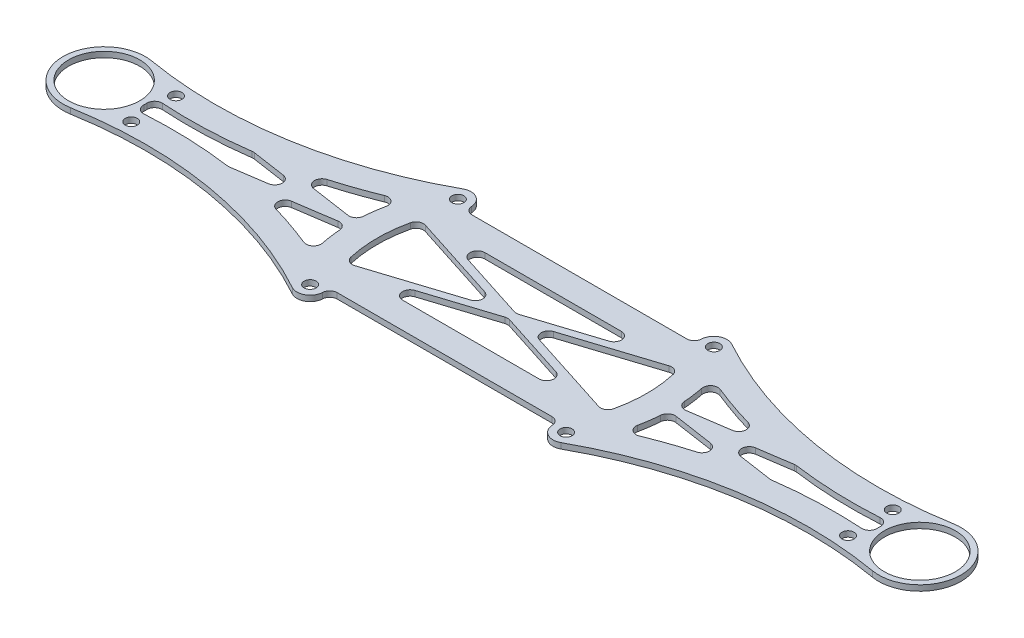
from build123d import *

# Parameters (mm, degrees)
BOSS_EXTRUDE1_DEPTH        = 0.75
F_3_2_3_2_DIAMETER_HOLE1_D = 3.2
SKETCH4_R                  = 9.5
CUT_EXTRUDE1_DEPTH         = 123.2407972
CUT_EXTRUDE4_DEPTH         = 123.2407972
FILLET1_R                  = 2


with BuildPart() as part:
    # Sketch1 → Boss-Extrude1 (new, symmetric)
    with BuildSketch(Plane(origin=(0, 0, 0), x_dir=(1, 0, 0), z_dir=(0, 1, 0))):
        with BuildLine():
            Line((31.176914536, 18), (-31.176914536, 18))
            ThreePointArc((-31.176914536, 18), (-31.70932212, 22.200834881), (-35.899079455, 22.81435343))
            ThreePointArc((-35.899079455, 22.81435343), (-70.492179883, 10.7556392), (-107.126701642, 10.839315166))
            ThreePointArc((-107.126701642, 10.839315166), (-120, 0), (-107.126701642, -10.839315166))
            ThreePointArc((-107.126701642, -10.839315166), (-70.492179883, -10.7556392), (-35.899079455, -22.81435343))
            ThreePointArc((-35.899079455, -22.81435343), (-31.70932212, -22.200834881), (-31.176914536, -18))
            Line((-31.176914536, -18), (31.176914536, -18))
            ThreePointArc((31.176914536, -18), (31.70932212, -22.200834881), (35.899079455, -22.81435343))
            ThreePointArc((35.899079455, -22.81435343), (70.492179883, -10.7556392), (107.126701642, -10.839315166))
            ThreePointArc((107.126701642, -10.839315166), (120, 0), (107.126701642, 10.839315166))
            ThreePointArc((107.126701642, 10.839315166), (70.492179883, 10.7556392), (35.899079455, 22.81435343))
            ThreePointArc((35.899079455, 22.81435343), (31.70932212, 22.200834881), (31.176914536, 18))
        make_face()
    extrude(amount=BOSS_EXTRUDE1_DEPTH, both=True)

    # Ø3.2 (3.2) Diameter Hole1 (through all)
    with Locations(Plane(origin=(0, 0.75, 0), x_dir=(1, 0, 0), z_dir=(0, 1, 0))):
        with Locations((-34.208003449, 19.75), (-34.208003449, -19.75), (34.208003449, -19.75), (34.208003449, 19.75), (-95.790276336, 5.979398024), (-95.790276336, -5.979398024), (95.790276336, 5.979398024), (95.790276336, -5.979398024)):
            Hole(F_3_2_3_2_DIAMETER_HOLE1_D / 2)

    # Sketch4 → Cut-Extrude1 (cut, through all)
    with BuildSketch(Plane(origin=(0, 0.75, 0), x_dir=(1, 0, 0), z_dir=(0, 1, 0))):
        with BuildLine():
            Line((-66.096117167, 4.443764231), (-42.988154947, 1.009224591))
            ThreePointArc((-42.988154947, 1.009224591), (-42.467311238, 6.747405149), (-41.183985346, 12.36443897))
            ThreePointArc((-41.183985346, 12.36443897), (-53.416219701, 7.70010587), (-66.096117167, 4.443764231))
        make_face()
        with BuildLine():
            ThreePointArc((-41.183985346, -12.36443897), (-42.467311238, -6.747405149), (-42.988154947, -1.009224591))
            Line((-42.988154947, -1.009224591), (-66.096117167, -4.443764231))
            ThreePointArc((-66.096117167, -4.443764231), (-53.416219701, -7.70010587), (-41.183985346, -12.36443897))
        make_face()
        with BuildLine():
            Line((-72.469338063, -3.369046694), (-49.802019621, 0))
            Line((-49.802019621, 0), (-72.469338063, 3.369046694))
            ThreePointArc((-72.469338063, 3.369046694), (-85.377857375, 2.290839769), (-98.326107181, 2.65857332))
            ThreePointArc((-98.326107181, 2.65857332), (-98, 0), (-98.326107181, -2.65857332))
            ThreePointArc((-98.326107181, -2.65857332), (-85.377857375, -2.290839769), (-72.469338063, -3.369046694))
        make_face()
        with BuildLine():
            ThreePointArc((-99.923426167, 2.804604689), (-118.5, 0), (-99.923426167, -2.804604689))
            ThreePointArc((-99.923426167, -2.804604689), (-99.5, 0), (-99.923426167, 2.804604689))
        make_face()
        with BuildLine():
            Line((72.469338063, 3.369046694), (49.802019621, 0))
            Line((49.802019621, 0), (72.469338063, -3.369046694))
            ThreePointArc((72.469338063, -3.369046694), (85.377857375, -2.290839769), (98.326107181, -2.65857332))
            ThreePointArc((98.326107181, -2.65857332), (98, 0), (98.326107181, 2.65857332))
            ThreePointArc((98.326107181, 2.65857332), (85.377857375, 2.290839769), (72.469338063, 3.369046694))
        make_face()
        with BuildLine():
            ThreePointArc((41.183985346, 12.36443897), (42.467311238, 6.747405149), (42.988154947, 1.009224591))
            Line((42.988154947, 1.009224591), (66.096117167, 4.443764231))
            ThreePointArc((66.096117167, 4.443764231), (53.416219701, 7.70010587), (41.183985346, 12.36443897))
        make_face()
        with BuildLine():
            Line((66.096117167, -4.443764231), (42.988154947, -1.009224591))
            ThreePointArc((42.988154947, -1.009224591), (42.467311238, -6.747405149), (41.183985346, -12.36443897))
            ThreePointArc((41.183985346, -12.36443897), (53.416219701, -7.70010587), (66.096117167, -4.443764231))
        make_face()
        with Locations((109, 0)):
            Circle(SKETCH4_R)
    extrude(amount=-CUT_EXTRUDE1_DEPTH, mode=Mode.SUBTRACT)

    # Sketch5 → Cut-Extrude4 (cut, through all)
    with BuildSketch(Plane(origin=(0, 0.75, 0), x_dir=(1, 0, 0), z_dir=(0, 1, 0))):
        Polygon((31.005545729, 11), (-31.005545729, 11), (0, 1.050227939), align=None)
        with BuildLine():
            Line((-3.272727273, 0), (-34.570601363, 10.043581104))
            ThreePointArc((-34.570601363, 10.043581104), (-36, 0), (-34.570601363, -10.043581104))
            Line((-34.570601363, -10.043581104), (-3.272727273, 0))
        make_face()
        with BuildLine():
            Line((34.570601363, 10.043581104), (3.272727273, 0))
            Line((3.272727273, 0), (34.570601363, -10.043581104))
            ThreePointArc((34.570601363, -10.043581104), (36, 0), (34.570601363, 10.043581104))
        make_face()
        Polygon((31.005545729, -11), (0, -1.050227939), (-31.005545729, -11), align=None)
    extrude(amount=-CUT_EXTRUDE4_DEPTH, mode=Mode.SUBTRACT)

    # Fillet1
    fillet1_edges = [part.edges().sort_by_distance(p)[0] for p in [
        (49.802019621, 0, 0),
        (-31.176914536, 0, 18),
        (-31.176914536, 0, -18),
        (31.176914536, 0, -18),
        (31.176914536, 0, 18),
        (41.183985346, 0, -12.36443897),
        (42.988154947, 0, -1.009224591),
        (42.988154947, 0, 1.009224591),
        (41.183985346, 0, 12.36443897),
        (66.096117167, 0, 4.443764231),
        (72.469338063, 0, 3.369046694),
        (72.469338063, 0, -3.369046694),
        (98.326107181, 0, -2.65857332),
        (98.326107181, 0, 2.65857332),
        (66.096117167, 0, -4.443764231),
        (31.005545729, 0, 11),
        (34.570601363, 0, 10.043581104),
        (31.005545729, 0, -11),
        (34.570601363, 0, -10.043581104),
        (0, 0, 1.050227939),
        (-3.272727273, 0, 0),
        (3.272727273, 0, 0),
        (-31.005545729, 0, -11),
        (-34.570601363, 0, -10.043581104),
        (-31.005545729, 0, 11),
        (0, 0, -1.050227939),
        (-34.570601363, 0, 10.043581104),
        (-66.096117167, 0, 4.443764231),
        (-66.096117167, 0, -4.443764231),
        (-41.183985346, 0, -12.36443897),
        (-42.988154947, 0, 1.009224591),
        (-49.802019621, 0, 0),
        (-41.183985346, 0, 12.36443897),
        (-42.988154947, 0, -1.009224591),
        (-72.469338063, 0, 3.369046694),
        (-72.469338063, 0, -3.369046694),
        (-98.326107181, 0, -2.65857332),
        (-98.326107181, 0, 2.65857332),
    ]]
    fillet(fillet1_edges, radius=FILLET1_R)


solid = part.part
